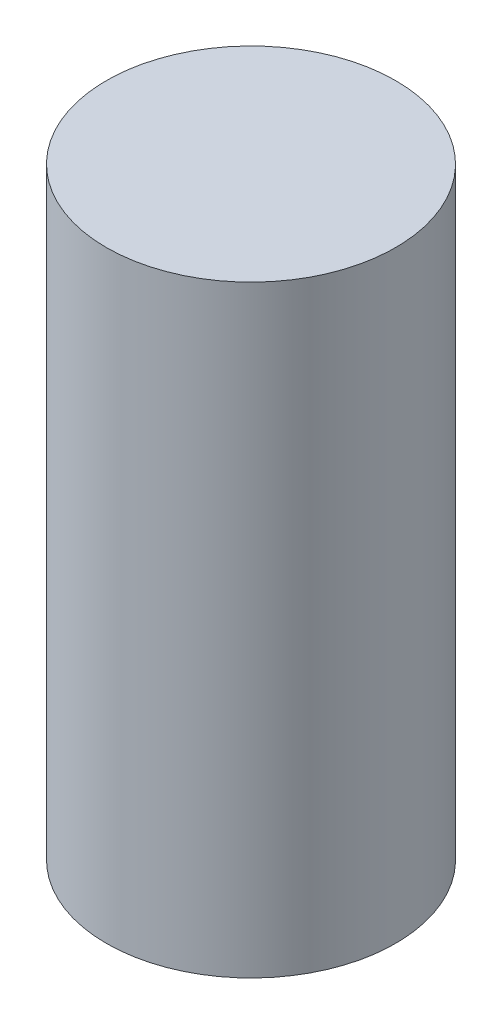
from build123d import *

# Parameters (mm, degrees)
SKETCH1_R           = 0.48
BOSS_EXTRUDE1_DEPTH = 2


with BuildPart() as part:
    # Sketch1 → Boss-Extrude1 (new body)
    with BuildSketch(Plane(origin=(0, 0, 0), x_dir=(1, 0, 0), z_dir=(0, 1, 0))):
        with Locations(Location((0, 0, 0), (0, 0, 270))):
            Circle(SKETCH1_R)
    extrude(amount=BOSS_EXTRUDE1_DEPTH)


solid = part.part
